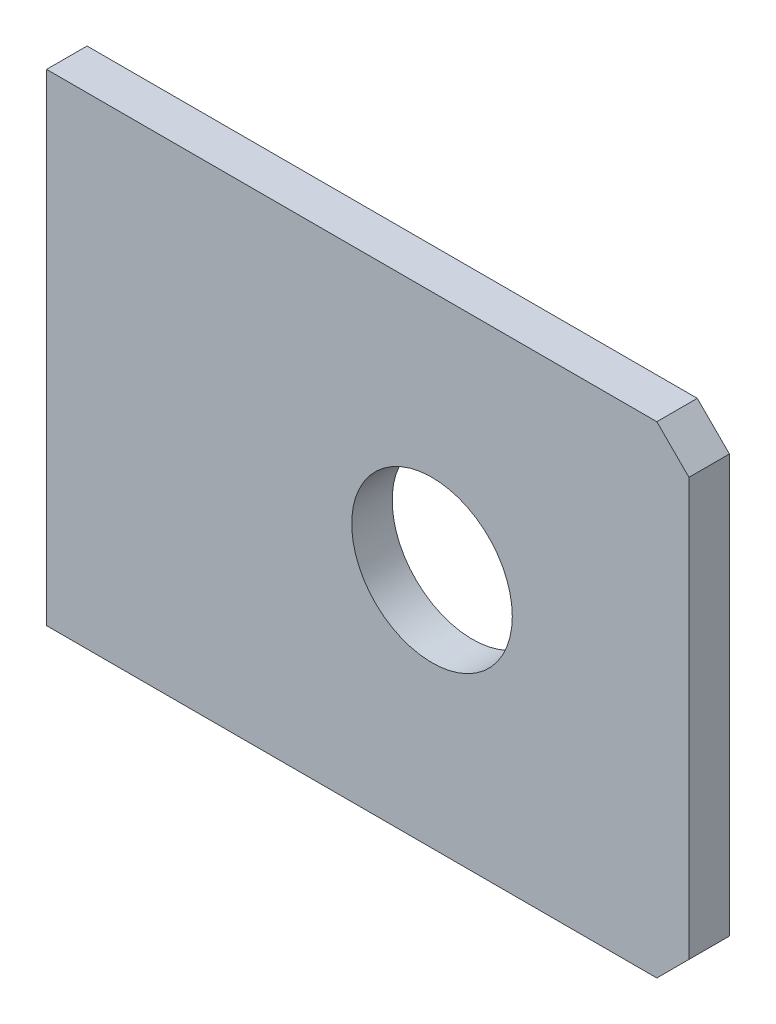
from build123d import *

# Parameters (mm, degrees)
ESBO_O1_R                = 2.5
RESSALTO_EXTRUS_O1_DEPTH = 1.26


with BuildPart() as part:
    # Esboço1 → Ressalto-extrusão1 (new body)
    with BuildSketch(Plane.XY):
        Polygon((14, -6.5), (14, 6.5), (13, 7.5), (-6, 7.5), (-6, -7.5), (13, -7.5), align=None)
        with Locations((6, 0)):
            Circle(ESBO_O1_R, mode=Mode.SUBTRACT)
    extrude(amount=RESSALTO_EXTRUS_O1_DEPTH)


solid = part.part
